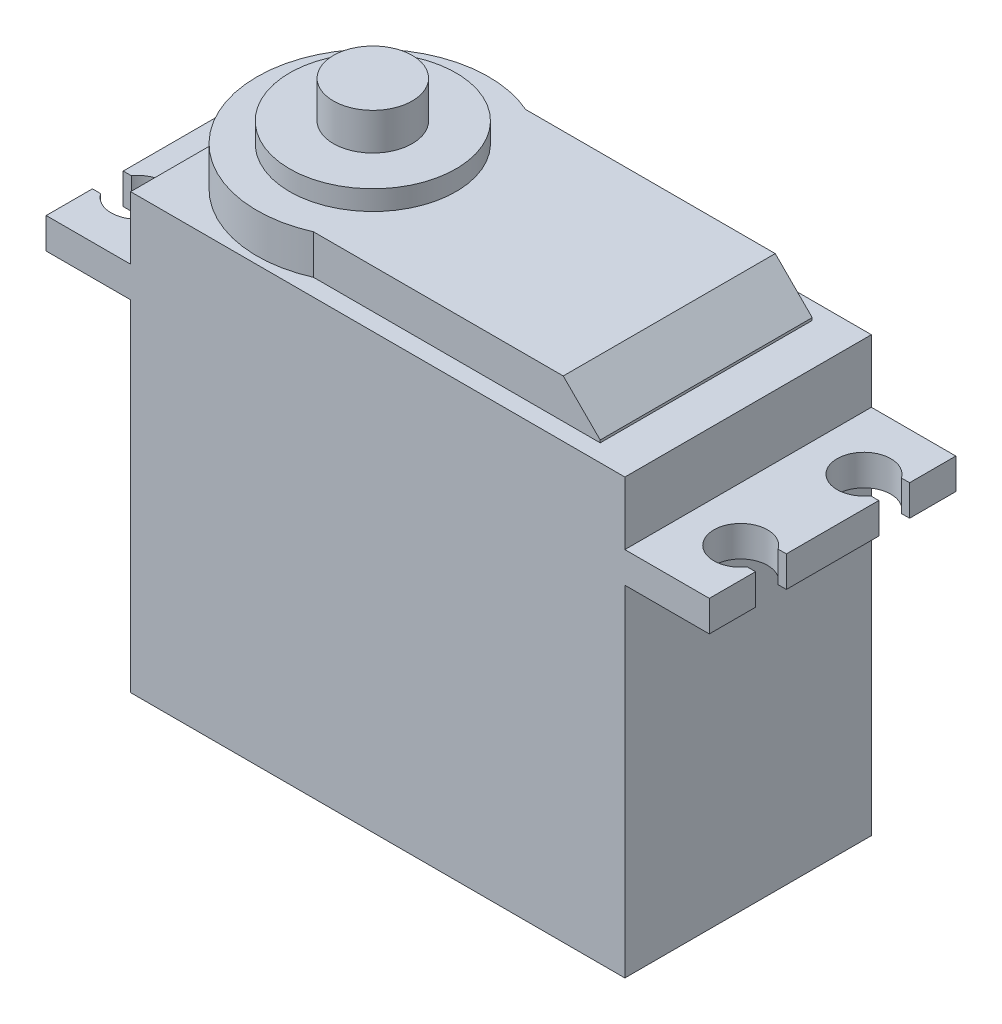
from build123d import *

# Parameters (mm, degrees)
BOSS_EXTRU_1_DEPTH      = 20
ENL_V_MAT_EXTRU_1_DEPTH = 60.247890258
ESQUISSE5_W             = 53.8
ESQUISSE5_H             = 20
ESQUISSE5_R             = 3.2
ENL_V_MAT_EXTRU_2_DEPTH = 3
ESQUISSE6_W             = 53.8
ESQUISSE6_H             = 20
ESQUISSE6_R             = 6.75
ENL_V_MAT_EXTRU_3_DEPTH = 1.6
ESQUISSE7_W             = 53.8
ESQUISSE7_H             = 20
ENL_V_MAT_EXTRU_4_DEPTH = 3.2
CHANFREIN2_SIZE         = 3


with BuildPart() as part:
    # Esquisse1 → Boss.-Extru.1 (new body)
    with BuildSketch(Plane.XY):
        Polygon((0, 0), (40.1, 0), (40.1, 27.6), (46.95, 27.6), (46.95, 30.1), (40.1, 30.1), (40.1, 35.2), (36.7, 35.2), (36.7, 38.4), (16.402, 38.4), (16.402, 40), (12.852, 40), (12.852, 43), (6.452, 43), (6.452, 40), (2.902, 40), (2.902, 38.4), (0, 38.4), (0, 30.1), (-6.85, 30.1), (-6.85, 27.6), (0, 27.6), align=None)
    extrude(amount=BOSS_EXTRU_1_DEPTH)

    # Esquisse2 → Enlèv. mat.-Extru.1 (cut, through all)
    with BuildSketch(Plane(origin=(0, 30.1, 0), x_dir=(1, 0, 0), z_dir=(0, 1, 0))):
        with BuildLine():
            Line((-6.85, -3.75), (-6.85, -6.25))
            Line((-6.85, -6.25), (-6.186029115, -6.25))
            ThreePointArc((-6.186029115, -6.25), (-2.22, -5), (-6.186029115, -3.75))
            Line((-6.186029115, -3.75), (-6.85, -3.75))
        make_face()
        with BuildLine():
            Line((46.95, -6.25), (46.286029115, -6.25))
            ThreePointArc((46.286029115, -6.25), (42.32, -5), (46.286029115, -3.75))
            Line((46.286029115, -3.75), (46.95, -3.75))
            Line((46.95, -3.75), (46.95, -6.25))
        make_face()
        with BuildLine():
            Line((46.95, -16.25), (46.286029115, -16.25))
            ThreePointArc((46.286029115, -16.25), (42.32, -15), (46.286029115, -13.75))
            Line((46.286029115, -13.75), (46.95, -13.75))
            Line((46.95, -13.75), (46.95, -16.25))
        make_face()
        with BuildLine():
            Line((-6.85, -13.75), (-6.186029115, -13.75))
            ThreePointArc((-6.186029115, -13.75), (-2.22, -15), (-6.186029115, -16.25))
            Line((-6.186029115, -16.25), (-6.85, -16.25))
            Line((-6.85, -16.25), (-6.85, -13.75))
        make_face()
    extrude(amount=-ENL_V_MAT_EXTRU_1_DEPTH, mode=Mode.SUBTRACT)

    # Esquisse5 → Enlèv. mat.-Extru.2 (cut)
    with BuildSketch(Plane(origin=(0, 43, 0), x_dir=(1, 0, 0), z_dir=(0, 1, 0))):
        with Locations((20.05, -10)):
            Rectangle(ESQUISSE5_W, ESQUISSE5_H)
        with Locations(Location((9.652, -10, 0), (0, 0, 180))):
            Circle(ESQUISSE5_R, mode=Mode.SUBTRACT)
    extrude(amount=-ENL_V_MAT_EXTRU_2_DEPTH, mode=Mode.SUBTRACT)

    # Esquisse6 → Enlèv. mat.-Extru.3 (cut)
    with BuildSketch(Plane(origin=(0, 40, 0), x_dir=(1, 0, 0), z_dir=(0, 1, 0))):
        with Locations((20.05, -10)):
            Rectangle(ESQUISSE6_W, ESQUISSE6_H)
        with Locations(Location((9.652, -10, 0), (0, 0, 270))):
            Circle(ESQUISSE6_R, mode=Mode.SUBTRACT)
    extrude(amount=-ENL_V_MAT_EXTRU_3_DEPTH, mode=Mode.SUBTRACT)

    # Esquisse7 → Enlèv. mat.-Extru.4 (cut)
    with BuildSketch(Plane(origin=(0, 38.4, 0), x_dir=(1, 0, 0), z_dir=(0, 1, 0))):
        with Locations((20.05, -10)):
            Rectangle(ESQUISSE7_W, ESQUISSE7_H)
        with BuildLine():
            Line((13.446733192, -18.6), (36.7, -18.6))
            Line((36.7, -18.6), (36.7, -1.4))
            Line((36.7, -1.4), (13.446733192, -1.4))
            ThreePointArc((13.446733192, -1.4), (0.252, -10), (13.446733192, -18.6))
        make_face(mode=Mode.SUBTRACT)
    extrude(amount=-ENL_V_MAT_EXTRU_4_DEPTH, mode=Mode.SUBTRACT)

    # Chanfrein2
    chanfrein2_edges = [part.edges().sort_by_distance(p)[0] for p in [
        (36.7, 38.4, 10),
    ]]
    chamfer(chanfrein2_edges, length=CHANFREIN2_SIZE)


solid = part.part
